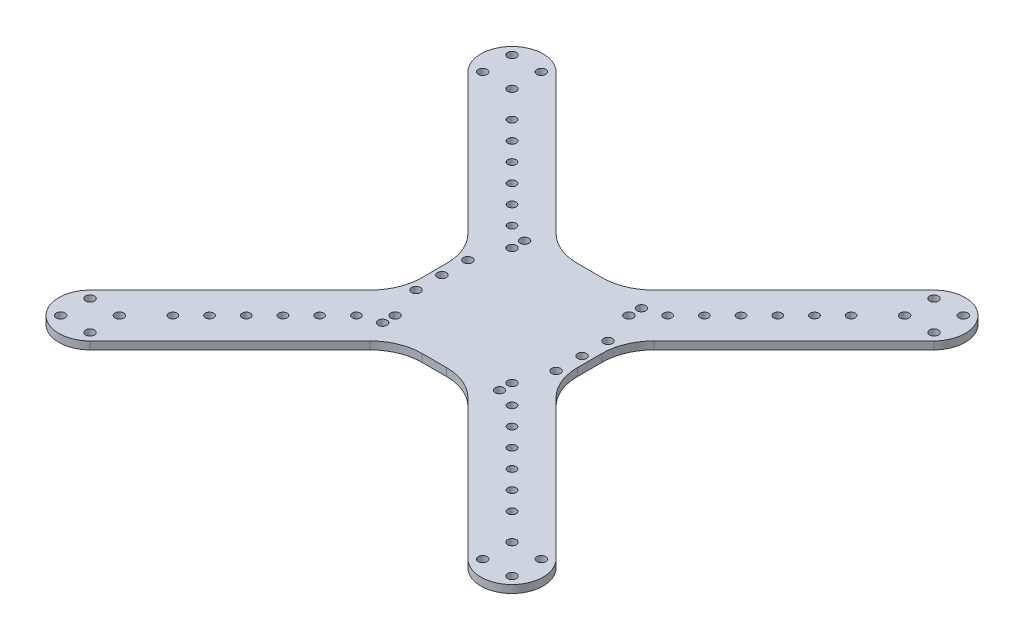
from build123d import *

# Parameters (mm, degrees)
BOSS_EXTRUDE1_DEPTH          = 3
FILLET1_R                    = 20
SKETCH2_R                    = 1.7
CUT_EXTRUDE1_DEPTH           = 133.004656858
CIRPATTERN1_COUNT            = 4
SKETCH3_R                    = 1.6
CUT_EXTRUDE2_DEPTH           = 133.004656858
LPATTERN1_COUNT              = 6
LPATTERN1_PITCH              = 10
CIRPATTERN2_COUNT            = 4
CIRPATTERN2_COPY_1_SKETCH_R  = 1.6
CIRPATTERN2_COPY_1_DEPTH     = 133.004656858
CIRPATTERN2_COPY_2_SKETCH_R  = 1.6
CIRPATTERN2_COPY_2_DEPTH     = 133.004656858
CIRPATTERN2_COPY_3_SKETCH_R  = 1.6
CIRPATTERN2_COPY_3_DEPTH     = 133.004656858
CIRPATTERN2_COPY_4_SKETCH_R  = 1.6
CIRPATTERN2_COPY_4_DEPTH     = 133.004656858
CIRPATTERN2_COPY_5_SKETCH_R  = 1.6
CIRPATTERN2_COPY_5_DEPTH     = 133.004656858
CIRPATTERN2_COPY_6_SKETCH_R  = 1.6
CIRPATTERN2_COPY_6_DEPTH     = 133.004656858
CIRPATTERN2_COPY_7_SKETCH_R  = 1.6
CIRPATTERN2_COPY_7_DEPTH     = 133.004656858
CIRPATTERN2_COPY_8_SKETCH_R  = 1.6
CIRPATTERN2_COPY_8_DEPTH     = 133.004656858
CIRPATTERN2_COPY_9_SKETCH_R  = 1.6
CIRPATTERN2_COPY_9_DEPTH     = 133.004656858
CIRPATTERN2_COPY_10_SKETCH_R = 1.6
CIRPATTERN2_COPY_10_DEPTH    = 133.004656858
CIRPATTERN2_COPY_11_SKETCH_R = 1.6
CIRPATTERN2_COPY_11_DEPTH    = 133.004656858
CIRPATTERN2_COPY_12_SKETCH_R = 1.6
CIRPATTERN2_COPY_12_DEPTH    = 133.004656858
CIRPATTERN2_COPY_13_SKETCH_R = 1.6
CIRPATTERN2_COPY_13_DEPTH    = 133.004656858
CIRPATTERN2_COPY_14_SKETCH_R = 1.6
CIRPATTERN2_COPY_14_DEPTH    = 133.004656858
CIRPATTERN2_COPY_15_SKETCH_R = 1.6
CIRPATTERN2_COPY_15_DEPTH    = 133.004656858
SKETCH4_R                    = 1.7
CUT_EXTRUDE3_DEPTH           = 133.004656858
CIRPATTERN3_COUNT            = 4
SKETCH5_R                    = 1.7
CUT_EXTRUDE4_DEPTH           = 133.004656858
SKETCH7_R                    = 1.7
CUT_EXTRUDE5_DEPTH           = 133.004656858
LPATTERN2_COUNT              = 2
LPATTERN2_PITCH              = 10
LPATTERN2_COL_COUNT          = 2
LPATTERN2_COL_PITCH          = 10
MIRROR2_COPY_1_SKETCH_R      = 1.7
MIRROR2_COPY_1_DEPTH         = 133.004656858
MIRROR2_COPY_2_SKETCH_R      = 1.7
MIRROR2_COPY_2_DEPTH         = 133.004656858


with BuildPart() as part:
    # Sketch1 → Boss-Extrude1 (new body)
    with BuildSketch(Plane(origin=(0, 0, 0), x_dir=(1, 0, 0), z_dir=(0, 1, 0))):
        with BuildLine():
            Line((-72.831998462, 89.802561211), (-13.029437252, 30))
            Line((-13.029437252, 30), (13.029437252, 30))
            Line((13.029437252, 30), (72.831998462, 89.802561211))
            ThreePointArc((72.831998462, 89.802561211), (89.802561211, 89.802561211), (89.802561211, 72.831998462))
            Line((89.802561211, 72.831998462), (30, 13.029437252))
            Line((30, 13.029437252), (30, -13.029437252))
            Line((30, -13.029437252), (89.802561211, -72.831998462))
            ThreePointArc((89.802561211, -72.831998462), (89.802561211, -89.802561211), (72.831998462, -89.802561211))
            Line((72.831998462, -89.802561211), (13.029437252, -30))
            Line((13.029437252, -30), (-13.029437252, -30))
            Line((-13.029437252, -30), (-72.831998462, -89.802561211))
            ThreePointArc((-72.831998462, -89.802561211), (-89.802561211, -89.802561211), (-89.802561211, -72.831998462))
            Line((-89.802561211, -72.831998462), (-30, -13.029437252))
            Line((-30, -13.029437252), (-30, 13.029437252))
            Line((-30, 13.029437252), (-89.802561211, 72.831998462))
            ThreePointArc((-89.802561211, 72.831998462), (-89.802561211, 89.802561211), (-72.831998462, 89.802561211))
        make_face()
    extrude(amount=BOSS_EXTRUDE1_DEPTH)

    # Fillet1
    fillet1_edges = [part.edges().sort_by_distance(p)[0] for p in [
        (-13.029437252, 1.5, -30),
        (13.029437252, 1.5, -30),
        (30, 1.5, -13.029437252),
        (30, 1.5, 13.029437252),
        (13.029437252, 1.5, 30),
        (-13.029437252, 1.5, 30),
        (-30, 1.5, 13.029437252),
        (-30, 1.5, -13.029437252),
    ]]
    fillet(fillet1_edges, radius=FILLET1_R)

    # Sketch2 → Cut-Extrude1 (cut, through all)
    with BuildSketch(Plane(origin=(0, 3, 0), x_dir=(1, 0, 0), z_dir=(0, 1, 0))):
        with Locations(Location((-22.525, -22.525, 0), (0, 0, 270))):
            Circle(SKETCH2_R)
    cut_extrude1 = extrude(amount=-CUT_EXTRUDE1_DEPTH, mode=Mode.SUBTRACT)

    # CirPattern1: Cut-Extrude1 ×4 about axis
    cirpattern1_axis = Axis((0, 0, 0), (0, 1, 0))
    for i in range(1, CIRPATTERN1_COUNT):
        add(cut_extrude1.rotate(cirpattern1_axis, i * 360 / CIRPATTERN1_COUNT), mode=Mode.SUBTRACT)

    # Sketch3 → Cut-Extrude2 (cut, through all)
    with BuildSketch(Plane(origin=(0, 3, 0), x_dir=(1, 0, 0), z_dir=(0, 1, 0))):
        with Locations(Location((-30, -30, 0), (0, 0, 270))):
            Circle(SKETCH3_R)
    cut_extrude2 = extrude(amount=-CUT_EXTRUDE2_DEPTH, mode=Mode.SUBTRACT)

    # LPattern1: Cut-Extrude2 ×6
    with Locations(*[Vector(-0.7071067811865467, 0, 0.7071067811865485) * (i * LPATTERN1_PITCH) for i in range(1, LPATTERN1_COUNT)]):
        add(cut_extrude2, mode=Mode.SUBTRACT)

    # CirPattern2: Cut-Extrude2 ×4 about axis
    cirpattern2_axis = Axis((0, 6.3, 0), (0, -1, 0))
    for i in range(1, CIRPATTERN2_COUNT):
        add(cut_extrude2.rotate(cirpattern2_axis, i * 360 / CIRPATTERN2_COUNT), mode=Mode.SUBTRACT)

    # CirPattern2 copy 1 sketch → CirPattern2 copy 1 (cut, through all)
    with BuildSketch(Plane(origin=(-7.071067812, 3, -7.071067812), x_dir=(0, 0, 1), z_dir=(0, 1, 0))):
        with Locations(Location((-30, -30, 0), (0, 0, 270))):
            Circle(CIRPATTERN2_COPY_1_SKETCH_R)
    extrude(amount=-CIRPATTERN2_COPY_1_DEPTH, mode=Mode.SUBTRACT)

    # CirPattern2 copy 2 sketch → CirPattern2 copy 2 (cut, through all)
    with BuildSketch(Plane(origin=(7.071067812, 3, -7.071067812), x_dir=(-1, 0, 0), z_dir=(0, 1, 0))):
        with Locations(Location((-30, -30, 0), (0, 0, 270))):
            Circle(CIRPATTERN2_COPY_2_SKETCH_R)
    extrude(amount=-CIRPATTERN2_COPY_2_DEPTH, mode=Mode.SUBTRACT)

    # CirPattern2 copy 3 sketch → CirPattern2 copy 3 (cut, through all)
    with BuildSketch(Plane(origin=(7.071067812, 3, 7.071067812), x_dir=(0, 0, -1), z_dir=(0, 1, 0))):
        with Locations(Location((-30, -30, 0), (0, 0, 270))):
            Circle(CIRPATTERN2_COPY_3_SKETCH_R)
    extrude(amount=-CIRPATTERN2_COPY_3_DEPTH, mode=Mode.SUBTRACT)

    # CirPattern2 copy 4 sketch → CirPattern2 copy 4 (cut, through all)
    with BuildSketch(Plane(origin=(-14.142135624, 3, -14.142135624), x_dir=(0, 0, 1), z_dir=(0, 1, 0))):
        with Locations(Location((-30, -30, 0), (0, 0, 270))):
            Circle(CIRPATTERN2_COPY_4_SKETCH_R)
    extrude(amount=-CIRPATTERN2_COPY_4_DEPTH, mode=Mode.SUBTRACT)

    # CirPattern2 copy 5 sketch → CirPattern2 copy 5 (cut, through all)
    with BuildSketch(Plane(origin=(14.142135624, 3, -14.142135624), x_dir=(-1, 0, 0), z_dir=(0, 1, 0))):
        with Locations(Location((-30, -30, 0), (0, 0, 270))):
            Circle(CIRPATTERN2_COPY_5_SKETCH_R)
    extrude(amount=-CIRPATTERN2_COPY_5_DEPTH, mode=Mode.SUBTRACT)

    # CirPattern2 copy 6 sketch → CirPattern2 copy 6 (cut, through all)
    with BuildSketch(Plane(origin=(14.142135624, 3, 14.142135624), x_dir=(0, 0, -1), z_dir=(0, 1, 0))):
        with Locations(Location((-30, -30, 0), (0, 0, 270))):
            Circle(CIRPATTERN2_COPY_6_SKETCH_R)
    extrude(amount=-CIRPATTERN2_COPY_6_DEPTH, mode=Mode.SUBTRACT)

    # CirPattern2 copy 7 sketch → CirPattern2 copy 7 (cut, through all)
    with BuildSketch(Plane(origin=(-21.213203436, 3, -21.213203436), x_dir=(0, 0, 1), z_dir=(0, 1, 0))):
        with Locations(Location((-30, -30, 0), (0, 0, 270))):
            Circle(CIRPATTERN2_COPY_7_SKETCH_R)
    extrude(amount=-CIRPATTERN2_COPY_7_DEPTH, mode=Mode.SUBTRACT)

    # CirPattern2 copy 8 sketch → CirPattern2 copy 8 (cut, through all)
    with BuildSketch(Plane(origin=(21.213203436, 3, -21.213203436), x_dir=(-1, 0, 0), z_dir=(0, 1, 0))):
        with Locations(Location((-30, -30, 0), (0, 0, 270))):
            Circle(CIRPATTERN2_COPY_8_SKETCH_R)
    extrude(amount=-CIRPATTERN2_COPY_8_DEPTH, mode=Mode.SUBTRACT)

    # CirPattern2 copy 9 sketch → CirPattern2 copy 9 (cut, through all)
    with BuildSketch(Plane(origin=(21.213203436, 3, 21.213203436), x_dir=(0, 0, -1), z_dir=(0, 1, 0))):
        with Locations(Location((-30, -30, 0), (0, 0, 270))):
            Circle(CIRPATTERN2_COPY_9_SKETCH_R)
    extrude(amount=-CIRPATTERN2_COPY_9_DEPTH, mode=Mode.SUBTRACT)

    # CirPattern2 copy 10 sketch → CirPattern2 copy 10 (cut, through all)
    with BuildSketch(Plane(origin=(-28.284271247, 3, -28.284271247), x_dir=(0, 0, 1), z_dir=(0, 1, 0))):
        with Locations(Location((-30, -30, 0), (0, 0, 270))):
            Circle(CIRPATTERN2_COPY_10_SKETCH_R)
    extrude(amount=-CIRPATTERN2_COPY_10_DEPTH, mode=Mode.SUBTRACT)

    # CirPattern2 copy 11 sketch → CirPattern2 copy 11 (cut, through all)
    with BuildSketch(Plane(origin=(28.284271247, 3, -28.284271247), x_dir=(-1, 0, 0), z_dir=(0, 1, 0))):
        with Locations(Location((-30, -30, 0), (0, 0, 270))):
            Circle(CIRPATTERN2_COPY_11_SKETCH_R)
    extrude(amount=-CIRPATTERN2_COPY_11_DEPTH, mode=Mode.SUBTRACT)

    # CirPattern2 copy 12 sketch → CirPattern2 copy 12 (cut, through all)
    with BuildSketch(Plane(origin=(28.284271247, 3, 28.284271247), x_dir=(0, 0, -1), z_dir=(0, 1, 0))):
        with Locations(Location((-30, -30, 0), (0, 0, 270))):
            Circle(CIRPATTERN2_COPY_12_SKETCH_R)
    extrude(amount=-CIRPATTERN2_COPY_12_DEPTH, mode=Mode.SUBTRACT)

    # CirPattern2 copy 13 sketch → CirPattern2 copy 13 (cut, through all)
    with BuildSketch(Plane(origin=(-35.355339059, 3, -35.355339059), x_dir=(0, 0, 1), z_dir=(0, 1, 0))):
        with Locations(Location((-30, -30, 0), (0, 0, 270))):
            Circle(CIRPATTERN2_COPY_13_SKETCH_R)
    extrude(amount=-CIRPATTERN2_COPY_13_DEPTH, mode=Mode.SUBTRACT)

    # CirPattern2 copy 14 sketch → CirPattern2 copy 14 (cut, through all)
    with BuildSketch(Plane(origin=(35.355339059, 3, -35.355339059), x_dir=(-1, 0, 0), z_dir=(0, 1, 0))):
        with Locations(Location((-30, -30, 0), (0, 0, 270))):
            Circle(CIRPATTERN2_COPY_14_SKETCH_R)
    extrude(amount=-CIRPATTERN2_COPY_14_DEPTH, mode=Mode.SUBTRACT)

    # CirPattern2 copy 15 sketch → CirPattern2 copy 15 (cut, through all)
    with BuildSketch(Plane(origin=(35.355339059, 3, 35.355339059), x_dir=(0, 0, -1), z_dir=(0, 1, 0))):
        with Locations(Location((-30, -30, 0), (0, 0, 270))):
            Circle(CIRPATTERN2_COPY_15_SKETCH_R)
    extrude(amount=-CIRPATTERN2_COPY_15_DEPTH, mode=Mode.SUBTRACT)

    # Sketch4 → Cut-Extrude3 (cut, through all)
    with BuildSketch(Plane(origin=(0, 3, 0), x_dir=(1, 0, 0), z_dir=(0, 1, 0))):
        with Locations(Location((-86.974134086, -86.974134086, 0), (0, 0, 270))):
            Circle(SKETCH4_R)
        with Locations(Location((-86.974134086, -75.660425587, 0), (0, 0, 270))):
            Circle(SKETCH4_R)
        with Locations(Location((-75.660425587, -75.660425587, 0), (0, 0, 270))):
            Circle(SKETCH4_R)
        with Locations(Location((-75.660425587, -86.974134086, 0), (0, 0, 270))):
            Circle(SKETCH4_R)
    cut_extrude3 = extrude(amount=-CUT_EXTRUDE3_DEPTH, mode=Mode.SUBTRACT)

    # CirPattern3: Cut-Extrude3 ×4 about axis
    cirpattern3_axis = Axis((0, 0, 0), (0, 1, 0))
    for i in range(1, CIRPATTERN3_COUNT):
        add(cut_extrude3.rotate(cirpattern3_axis, i * 360 / CIRPATTERN3_COUNT), mode=Mode.SUBTRACT)

    # Sketch5 → Cut-Extrude4 (cut, through all)
    with BuildSketch(Plane(origin=(0, 3, 0), x_dir=(1, 0, 0), z_dir=(0, 1, 0))):
        with Locations(Location((-22.525, 27.375, 0), (0, 0, 270))):
            Circle(SKETCH5_R)
        with Locations(Location((-22.525, -27.35, 0), (0, 0, 270))):
            Circle(SKETCH5_R)
    cut_extrude4 = extrude(amount=-CUT_EXTRUDE4_DEPTH, mode=Mode.SUBTRACT)

    # Mirror1: Cut-Extrude4 across plane
    add(cut_extrude4.mirror(Plane(origin=(0, 0, 0), x_dir=(0, 0, 1), z_dir=(1, 0, 0))), mode=Mode.SUBTRACT)

    # Sketch7 → Cut-Extrude5 (cut, through all)
    with BuildSketch(Plane(origin=(0, 3, 0), x_dir=(1, 0, 0), z_dir=(0, 1, 0))):
        with Locations(Location((-27, 0, 0), (0, 0, 270))):
            Circle(SKETCH7_R)
    cut_extrude5 = extrude(amount=-CUT_EXTRUDE5_DEPTH, mode=Mode.SUBTRACT)

    # LPattern2: Cut-Extrude5 ×2
    with Locations(*[(0, 0, i * LPATTERN2_PITCH) for i in range(1, LPATTERN2_COUNT)]):
        add(cut_extrude5, mode=Mode.SUBTRACT)

    # LPattern2 col: Cut-Extrude5 ×2
    with Locations(*[(0, 0, -i * LPATTERN2_COL_PITCH) for i in range(1, LPATTERN2_COL_COUNT)]):
        add(cut_extrude5, mode=Mode.SUBTRACT)

    # Mirror2: Cut-Extrude5 across plane
    add(cut_extrude5.mirror(Plane(origin=(0, 0, 0), x_dir=(0, 0, 1), z_dir=(1, 0, 0))), mode=Mode.SUBTRACT)

    # Mirror2 copy 1 sketch → Mirror2 copy 1 (cut, through all)
    with BuildSketch(Plane(origin=(0, 3, 10), x_dir=(-1, 0, 0), z_dir=(0, 1, 0))):
        with Locations((-27, 0)):
            Circle(MIRROR2_COPY_1_SKETCH_R)
    extrude(amount=-MIRROR2_COPY_1_DEPTH, mode=Mode.SUBTRACT)

    # Mirror2 copy 2 sketch → Mirror2 copy 2 (cut, through all)
    with BuildSketch(Plane(origin=(0, 3, -10), x_dir=(-1, 0, 0), z_dir=(0, 1, 0))):
        with Locations((-27, 0)):
            Circle(MIRROR2_COPY_2_SKETCH_R)
    extrude(amount=-MIRROR2_COPY_2_DEPTH, mode=Mode.SUBTRACT)


solid = part.part
